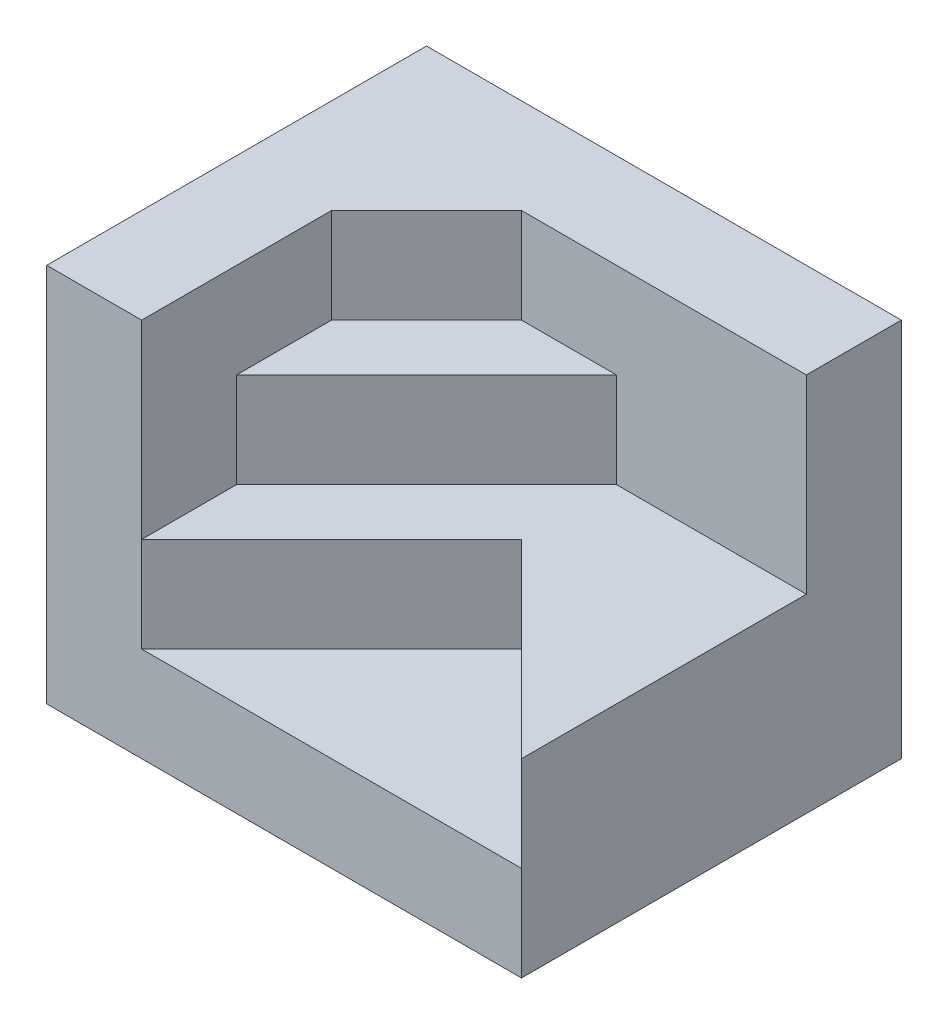
from build123d import *

# Parameters (mm, degrees)
SKETCH_1_W      = 5
SKETCH_1_H      = 4
EXTRUDE_1_DEPTH = 1
EXTRUDE_2_DEPTH = 3
EXTRUDE_3_DEPTH = 1
EXTRUDE_4_DEPTH = 1


with BuildPart() as part:
    # 草圖1 → 填料-伸長1 (new body)
    with BuildSketch(Plane(origin=(0, 0, 0), x_dir=(1, 0, 0), z_dir=(0, 1, 0))):
        with Locations((2.5, 2)):
            Rectangle(SKETCH_1_W, SKETCH_1_H)
    extrude(amount=EXTRUDE_1_DEPTH)

    # 草圖2 → 填料-伸長2 (add)
    with BuildSketch(Plane(origin=(0, 1, 0), x_dir=(1, 0, 0), z_dir=(0, 1, 0))):
        Polygon((0, 0), (1, 0), (1, 2), (2, 3), (5, 3), (5, 4), (0, 4), align=None)
    extrude(amount=EXTRUDE_2_DEPTH)

    # 草圖3 → 填料-伸長3 (add)
    with BuildSketch(Plane(origin=(0, 1, 0), x_dir=(1, 0, 0), z_dir=(0, 1, 0))):
        Polygon((5, 0), (3, 2), (1, 0), (1, 2), (2, 3), (5, 3), align=None)
    extrude(amount=EXTRUDE_3_DEPTH)

    # 草圖4 → 填料-伸長4 (add)
    with BuildSketch(Plane(origin=(0, 2, 0), x_dir=(1, 0, 0), z_dir=(0, 1, 0))):
        Polygon((1, 2), (2, 3), (3, 3), (1, 1), align=None)
    extrude(amount=EXTRUDE_4_DEPTH)


solid = part.part
